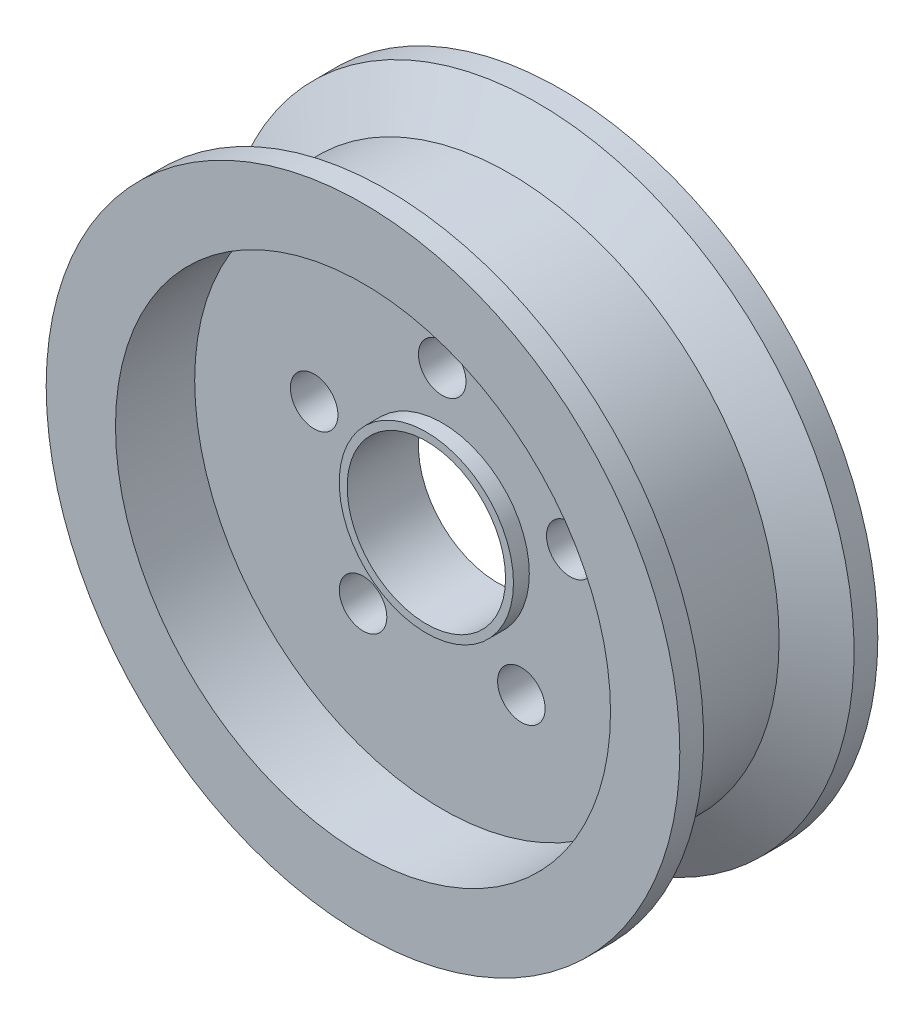
from build123d import *

# Parameters (mm, degrees)
SKETCH2_R           = 40
SKETCH2_R_2         = 10
BOSS_EXTRUDE1_DEPTH = 12.5
SKETCH3_R           = 31.25
CUT_EXTRUDE1_DEPTH  = 10
SKETCH6_R           = 11
SKETCH6_R_2         = 10
BOSS_EXTRUDE2_DEPTH = 2
SKETCH4_R           = 3
CUT_EXTRUDE2_DEPTH  = 59.523499554
CIRPATTERN1_COUNT   = 5


with BuildPart() as part:
    # Sketch2 → Boss-Extrude1 (new, symmetric)
    with BuildSketch(Plane.XY):
        Circle(SKETCH2_R)
        Circle(SKETCH2_R_2, mode=Mode.SUBTRACT)
    extrude(amount=BOSS_EXTRUDE1_DEPTH, both=True)

    # Sketch3 → Cut-Extrude1 (cut)
    with BuildSketch(Plane.XY.offset(12.5)):
        Circle(SKETCH3_R)
    cut_extrude1 = extrude(amount=-CUT_EXTRUDE1_DEPTH, mode=Mode.SUBTRACT)

    # Sketch6 → Boss-Extrude2 (add)
    with BuildSketch(Plane.XY.offset(2.5)):
        Circle(SKETCH6_R)
        Circle(SKETCH6_R_2, mode=Mode.SUBTRACT)
    boss_extrude2 = extrude(amount=BOSS_EXTRUDE2_DEPTH)

    # Mirror1: Cut-Extrude1, Boss-Extrude2 across plane
    add(cut_extrude1.mirror(Plane.XY), mode=Mode.SUBTRACT)
    add(boss_extrude2.mirror(Plane.XY))

    # Sketch4 → Cut-Extrude2 (cut, through all)
    with BuildSketch(Plane.XY.offset(2.5)):
        with Locations((0, 17)):
            Circle(SKETCH4_R)
    cut_extrude2 = extrude(amount=-CUT_EXTRUDE2_DEPTH, mode=Mode.SUBTRACT)

    # CirPattern1: Cut-Extrude2 ×5 about axis
    cirpattern1_axis = Axis((0, 0, 0), (0, 0, 1))
    for i in range(1, CIRPATTERN1_COUNT):
        add(cut_extrude2.rotate(cirpattern1_axis, i * 360 / CIRPATTERN1_COUNT), mode=Mode.SUBTRACT)

    # Sketch5 → Cut-Revolve1 (revolve, cut)
    with BuildSketch(Plane(origin=(0, 0, 0), x_dir=(1, 0, 0), z_dir=(0, 1, 0)), mode=Mode.PRIVATE) as cut_revolve1_sk:
        Polygon((40, 9.5), (34, 6.035898385), (34, -6.035898385), (40, -9.5), align=None)
    revolve(cut_revolve1_sk.sketch.rotate(Axis((0, 0, -19.267509915), (0, 0, 1)), 180), axis=Axis((0, 0, -19.267509915), (0, 0, 1)), mode=Mode.SUBTRACT)


solid = part.part
